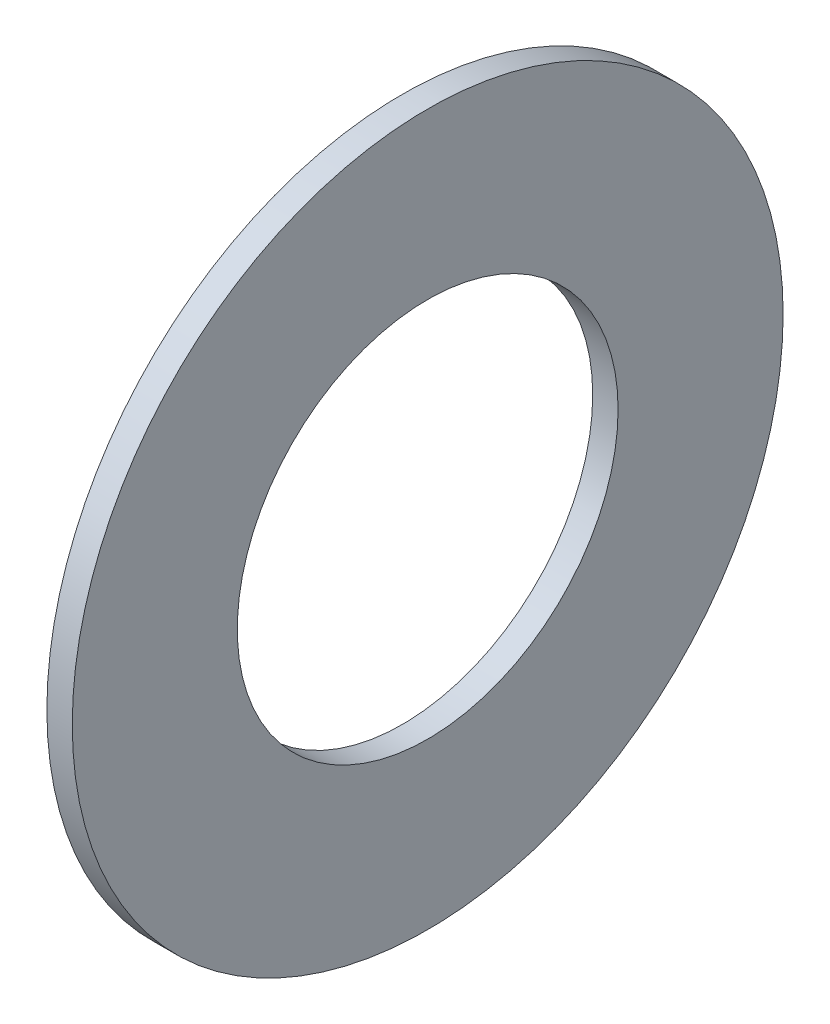
from build123d import *

# Parameters (mm, degrees)
SKETCH1_R      = 14
SKETCH1_R_2    = 7.5
EXTRUDE1_DEPTH = 1


with BuildPart() as part:
    # Sketch1 → Extrude1 (new body)
    with BuildSketch(Plane(origin=(0, 0, 0), x_dir=(0, 0, -1), z_dir=(1, 0, 0))):
        Circle(SKETCH1_R)
        Circle(SKETCH1_R_2, mode=Mode.SUBTRACT)
    extrude(amount=EXTRUDE1_DEPTH)


solid = part.part
